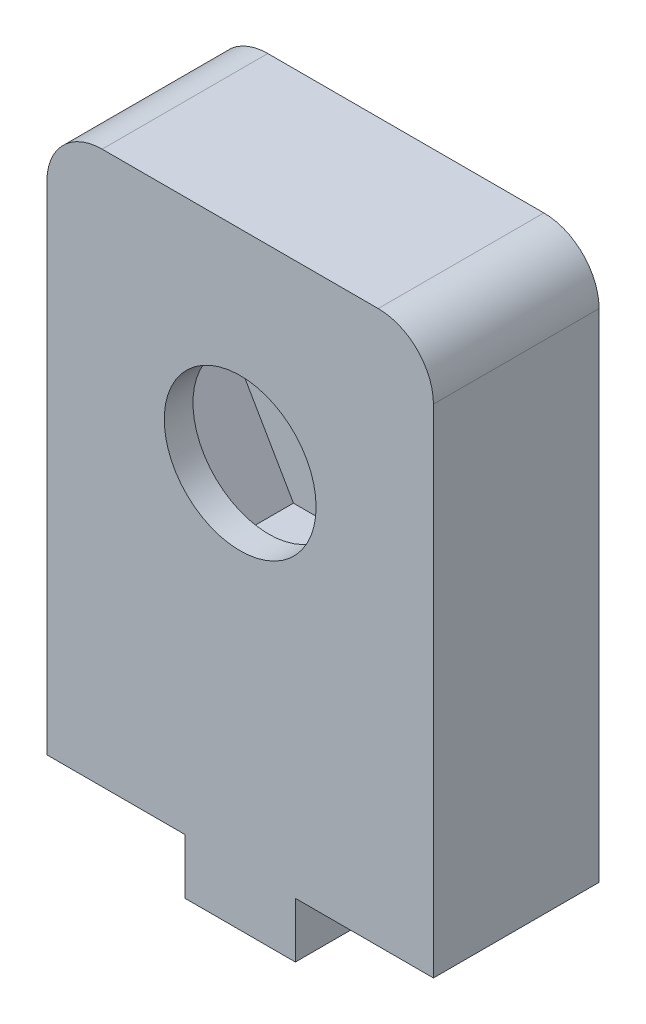
from build123d import *

# Parameters (mm, degrees)
SKETCH1_R           = 1.375
BOSS_EXTRUDE1_DEPTH = 3
CUT_EXTRUDE1_DEPTH  = 0.98


with BuildPart() as part:
    # Sketch1 → Boss-Extrude1 (new body)
    with BuildSketch(Plane.XY):
        with BuildLine():
            Line((-1, -5), (-1, -6))
            Line((-1, -6), (1, -6))
            Line((1, -6), (1, -5))
            Line((1, -5), (3.5, -5))
            Line((3.5, -5), (3.5, 4))
            ThreePointArc((3.5, 4), (3.207106781, 4.707106781), (2.5, 5))
            Line((2.5, 5), (-2.5, 5))
            ThreePointArc((-2.5, 5), (-3.207106781, 4.707106781), (-3.5, 4))
            Line((-3.5, 4), (-3.5, -5))
            Line((-3.5, -5), (-1, -5))
        make_face()
        with Locations((0, 1.325)):
            Circle(SKETCH1_R, mode=Mode.SUBTRACT)
    extrude(amount=BOSS_EXTRUDE1_DEPTH)

    # Sketch2 → Cut-Extrude1 (cut, symmetric)
    with BuildSketch(Plane.XY.offset(1.5)):
        Polygon((3.031088913, 1.325), (1.515544457, 3.95), (-1.515544457, 3.95), (-3.031088913, 1.325), (-1.515544457, -1.3), (1.515544457, -1.3), align=None)
    extrude(amount=CUT_EXTRUDE1_DEPTH, both=True, mode=Mode.SUBTRACT)


solid = part.part
